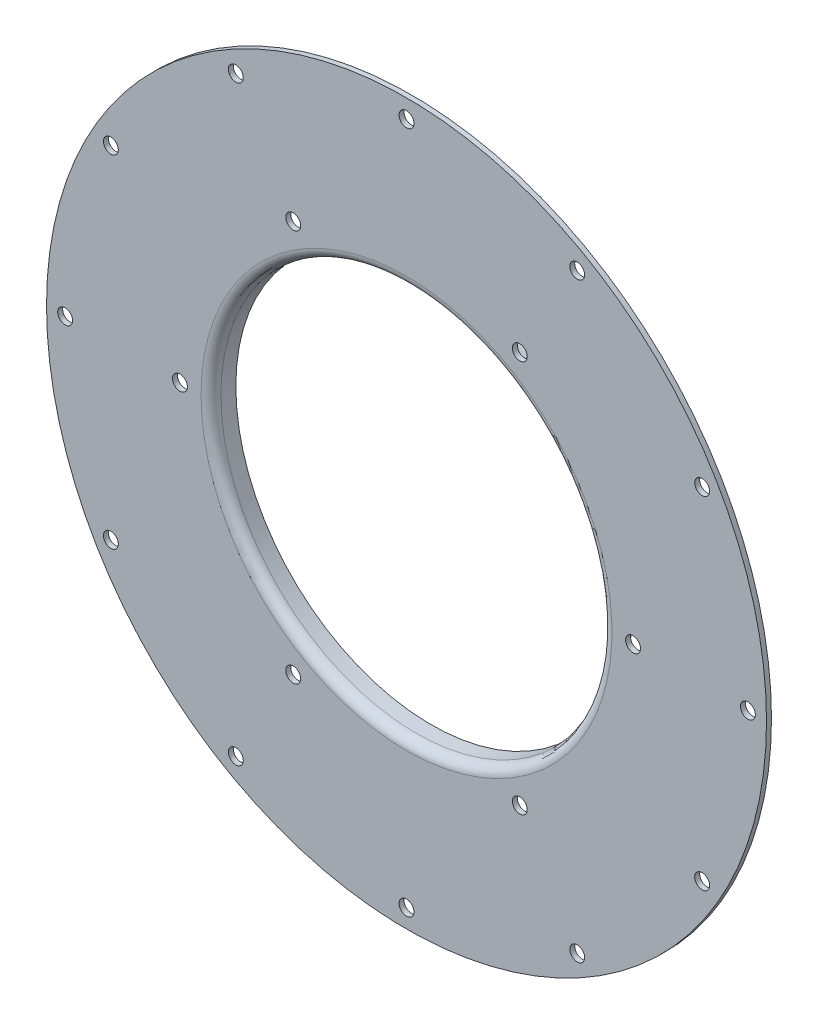
from build123d import *

# Parameters (mm, degrees)
SKETCH2_R          = 6
CUT_EXTRUDE1_DEPTH = 10
CIRPATTERN1_COUNT  = 6
SKETCH3_R          = 6
CUT_EXTRUDE2_DEPTH = 10
CIRPATTERN2_COUNT  = 12


with BuildPart() as part:
    # Sketch1 → Revolve1 (revolve)
    with BuildSketch(Plane(origin=(0, 0, 0), x_dir=(1, 0, 0), z_dir=(0, 1, 0))):
        with BuildLine():
            Line((-161.5, 8), (-161.5, 20))
            Line((-161.5, 20), (-157.5, 20))
            Line((-157.5, 20), (-157.5, 8))
            ThreePointArc((-157.5, 8), (-159.843145751, 2.343145751), (-165.5, 0))
            Line((-165.5, 0), (-290, 0))
            Line((-290, 0), (-290, 4))
            Line((-290, 4), (-165.5, 4))
            ThreePointArc((-165.5, 4), (-162.671572875, 5.171572875), (-161.5, 8))
        make_face()
    revolve(axis=Axis((0, 0, 0), (0, 0, 1)))

    # Sketch2 → Cut-Extrude1 (cut)
    with BuildSketch(Plane.XY):
        with Locations((182.5, 0)):
            Circle(SKETCH2_R)
    cut_extrude1 = extrude(amount=-CUT_EXTRUDE1_DEPTH, mode=Mode.SUBTRACT)

    # CirPattern1: Cut-Extrude1 ×6 about axis
    cirpattern1_axis = Axis((0, 0, 0), (0, 0, 1))
    for i in range(1, CIRPATTERN1_COUNT):
        add(cut_extrude1.rotate(cirpattern1_axis, i * 360 / CIRPATTERN1_COUNT), mode=Mode.SUBTRACT)

    # Sketch3 → Cut-Extrude2 (cut)
    with BuildSketch(Plane.XY):
        with Locations((275, 0)):
            Circle(SKETCH3_R)
    cut_extrude2 = extrude(amount=-CUT_EXTRUDE2_DEPTH, mode=Mode.SUBTRACT)

    # CirPattern2: Cut-Extrude2 ×12 about axis
    cirpattern2_axis = Axis((0, 0, 0), (0, 0, 1))
    for i in range(1, CIRPATTERN2_COUNT):
        add(cut_extrude2.rotate(cirpattern2_axis, i * 360 / CIRPATTERN2_COUNT), mode=Mode.SUBTRACT)


solid = part.part
